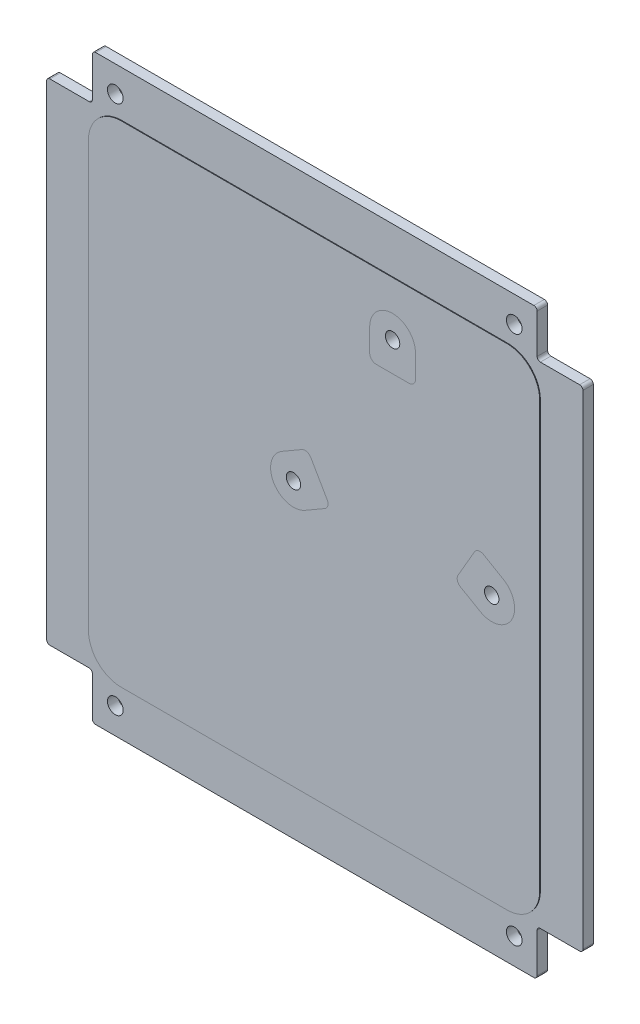
from build123d import *

# Parameters (mm, degrees)
BOSS_EXTRUDE1_DEPTH            = 1.6
BOSS_EXTRUDE2_DEPTH            = 0.1
M2_HOLE1_FIXINGSTRUCTURE_D     = 2.4
M2_HOLE1_FIXINGSTRUCTURE_DEPTH = 200
M2_HOLE1_FIXINGSTRUCTURE_TIP   = 0.721032743
SKETCH5_R                      = 1.1
CUT_EXTRUDE1_DEPTH             = 1.7


with BuildPart() as part:
    # Sketch1 → Boss-Extrude1 (new body)
    with BuildSketch(Plane.XY):
        with BuildLine():
            Line((-34, 44), (-34, 38))
            ThreePointArc((-34, 38), (-34.146446609, 37.646446609), (-34.5, 37.5))
            Line((-34.5, 37.5), (-40.5, 37.5))
            ThreePointArc((-40.5, 37.5), (-40.853553391, 37.353553391), (-41, 37))
            Line((-41, 37), (-41, -37))
            ThreePointArc((-41, -37), (-40.853553391, -37.353553391), (-40.5, -37.5))
            Line((-40.5, -37.5), (-34.5, -37.5))
            ThreePointArc((-34.5, -37.5), (-34.146446609, -37.646446609), (-34, -38))
            Line((-34, -38), (-34, -44))
            ThreePointArc((-34, -44), (-33.853553391, -44.353553391), (-33.5, -44.5))
            Line((-33.5, -44.5), (33.5, -44.5))
            ThreePointArc((33.5, -44.5), (33.853553391, -44.353553391), (34, -44))
            Line((34, -44), (34, -38))
            ThreePointArc((34, -38), (34.146446609, -37.646446609), (34.5, -37.5))
            Line((34.5, -37.5), (40.5, -37.5))
            ThreePointArc((40.5, -37.5), (40.853553391, -37.353553391), (41, -37))
            Line((41, -37), (41, 37))
            ThreePointArc((41, 37), (40.853553391, 37.353553391), (40.5, 37.5))
            Line((40.5, 37.5), (34.5, 37.5))
            ThreePointArc((34.5, 37.5), (34.146446609, 37.646446609), (34, 38))
            Line((34, 38), (34, 44))
            ThreePointArc((34, 44), (33.853553391, 44.353553391), (33.5, 44.5))
            Line((33.5, 44.5), (-33.5, 44.5))
            ThreePointArc((-33.5, 44.5), (-33.853553391, 44.353553391), (-34, 44))
        make_face()
    extrude(amount=BOSS_EXTRUDE1_DEPTH)

    # Esboço1 → Boss-Extrude2 (add)
    with BuildSketch(Plane.XY.offset(1.6)):
        with BuildLine():
            Line((-29.5, -37.5), (29.5, -37.5))
            ThreePointArc((29.5, -37.5), (33.035533906, -36.035533906), (34.5, -32.5))
            Line((34.5, -32.5), (34.5, 32.5))
            ThreePointArc((34.5, 32.5), (33.035533906, 36.035533906), (29.5, 37.5))
            Line((29.5, 37.5), (-29.5, 37.5))
            ThreePointArc((-29.5, 37.5), (-33.035533906, 36.035533906), (-34.5, 32.5))
            Line((-34.5, 32.5), (-34.5, -32.5))
            ThreePointArc((-34.5, -32.5), (-33.035533906, -36.035533906), (-29.5, -37.5))
        make_face()
    extrude(amount=BOSS_EXTRUDE2_DEPTH)

    # M2 Hole1-FixingStructure
    with Locations(Plane(origin=(0, 0, 0), x_dir=(-1, 0, 0), z_dir=(0, 0, -1))):
        with Locations((-30.5, 40.5), (30.5, 40.5), (-30.5, -40.5), (30.5, -40.5)):
            Hole(M2_HOLE1_FIXINGSTRUCTURE_D / 2, depth=M2_HOLE1_FIXINGSTRUCTURE_DEPTH)
            with Locations((0, 0, -(M2_HOLE1_FIXINGSTRUCTURE_DEPTH + M2_HOLE1_FIXINGSTRUCTURE_TIP / 2))):  # 118° drill point
                Cone(0, M2_HOLE1_FIXINGSTRUCTURE_D / 2, M2_HOLE1_FIXINGSTRUCTURE_TIP, mode=Mode.SUBTRACT)

    # Sketch5 → Cut-Extrude1 (cut)
    with BuildSketch(Plane.XY.offset(1.7)):
        with Locations((27.155444566, 3)):
            Circle(SKETCH5_R)
        with Locations((12, 29.25)):
            Circle(SKETCH5_R)
        with Locations((-3.155444566, 3)):
            Circle(SKETCH5_R)
    extrude(amount=-CUT_EXTRUDE1_DEPTH, mode=Mode.SUBTRACT)


solid = part.part
